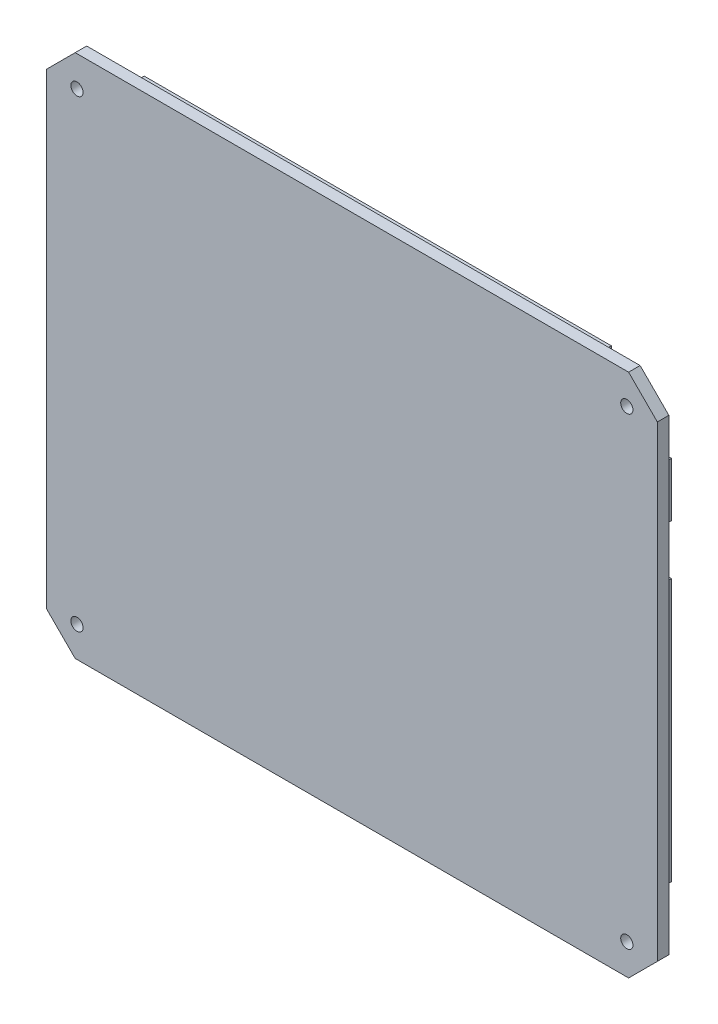
from build123d import *

# Parameters (mm, degrees)
COVER_START                                = 4
COVER_3_2_FOUR_SCREW_CLEARANCES_D3_4_P_R   = 1.7
COVER_3_2_FOUR_SCREW_CLEARANCES_D3_4_DEPTH = 3.2
LOCATING_LIPS_0_45_WALL_CLEARANCE_PROF_W   = 130
LOCATING_LIPS_0_45_WALL_CLEARANCE_PROF_H   = 1.6
LOCATING_LIPS_0_45_WALL_CLEARANCE_PROF_W_2 = 1.6
LOCATING_LIPS_0_45_WALL_CLEARANCE_PROF_H_2 = 70
LOCATING_LIPS_0_45_WALL_CLEARANCE_PROF_H_3 = 12
LOCATING_LIPS_0_45_WALL_CLEARANCE_PROF_H_4 = 73
LOCATING_LIPS_0_45_WALL_CLEARANCE_PROF_H_5 = 15
LOCATING_LIPS_0_45_WALL_CLEARANCE_DEPTH    = 4


with BuildPart() as part:
    # Cover 3.2 - four screw clearances D3.4 profile → Cover 3.2 - four screw clearances D3.4 (new body)
    with BuildSketch(Plane.XY.offset(COVER_START)):
        Polygon((-77, -73), (77, -73), (85, -65), (85, 65), (77, 73), (-77, 73), (-85, 65), (-85, -65), align=None)
        with Locations((-76.5, -64.5)):
            Circle(COVER_3_2_FOUR_SCREW_CLEARANCES_D3_4_P_R, mode=Mode.SUBTRACT)
        with Locations((-76.5, 64.5)):
            Circle(COVER_3_2_FOUR_SCREW_CLEARANCES_D3_4_P_R, mode=Mode.SUBTRACT)
        with Locations((76.5, -64.5)):
            Circle(COVER_3_2_FOUR_SCREW_CLEARANCES_D3_4_P_R, mode=Mode.SUBTRACT)
        with Locations((76.5, 64.5)):
            Circle(COVER_3_2_FOUR_SCREW_CLEARANCES_D3_4_P_R, mode=Mode.SUBTRACT)
    extrude(amount=COVER_3_2_FOUR_SCREW_CLEARANCES_D3_4_DEPTH)

    # Locating lips - 0.45 wall clearance profile → Locating lips - 0.45 wall clearance (add)
    with BuildSketch(Plane.XY):
        with Locations((0, -68.95)):
            Rectangle(LOCATING_LIPS_0_45_WALL_CLEARANCE_PROF_W, LOCATING_LIPS_0_45_WALL_CLEARANCE_PROF_H)
        with Locations((0, 68.95)):
            Rectangle(LOCATING_LIPS_0_45_WALL_CLEARANCE_PROF_W, LOCATING_LIPS_0_45_WALL_CLEARANCE_PROF_H)
        with Locations((-80.95, -16)):
            Rectangle(LOCATING_LIPS_0_45_WALL_CLEARANCE_PROF_W_2, LOCATING_LIPS_0_45_WALL_CLEARANCE_PROF_H_2)
        with Locations((-80.95, 45)):
            Rectangle(LOCATING_LIPS_0_45_WALL_CLEARANCE_PROF_W_2, LOCATING_LIPS_0_45_WALL_CLEARANCE_PROF_H_3)
        with Locations((80.95, -14.5)):
            Rectangle(LOCATING_LIPS_0_45_WALL_CLEARANCE_PROF_W_2, LOCATING_LIPS_0_45_WALL_CLEARANCE_PROF_H_4)
        with Locations((80.95, 43.5)):
            Rectangle(LOCATING_LIPS_0_45_WALL_CLEARANCE_PROF_W_2, LOCATING_LIPS_0_45_WALL_CLEARANCE_PROF_H_5)
    extrude(amount=LOCATING_LIPS_0_45_WALL_CLEARANCE_DEPTH)


solid = part.part
